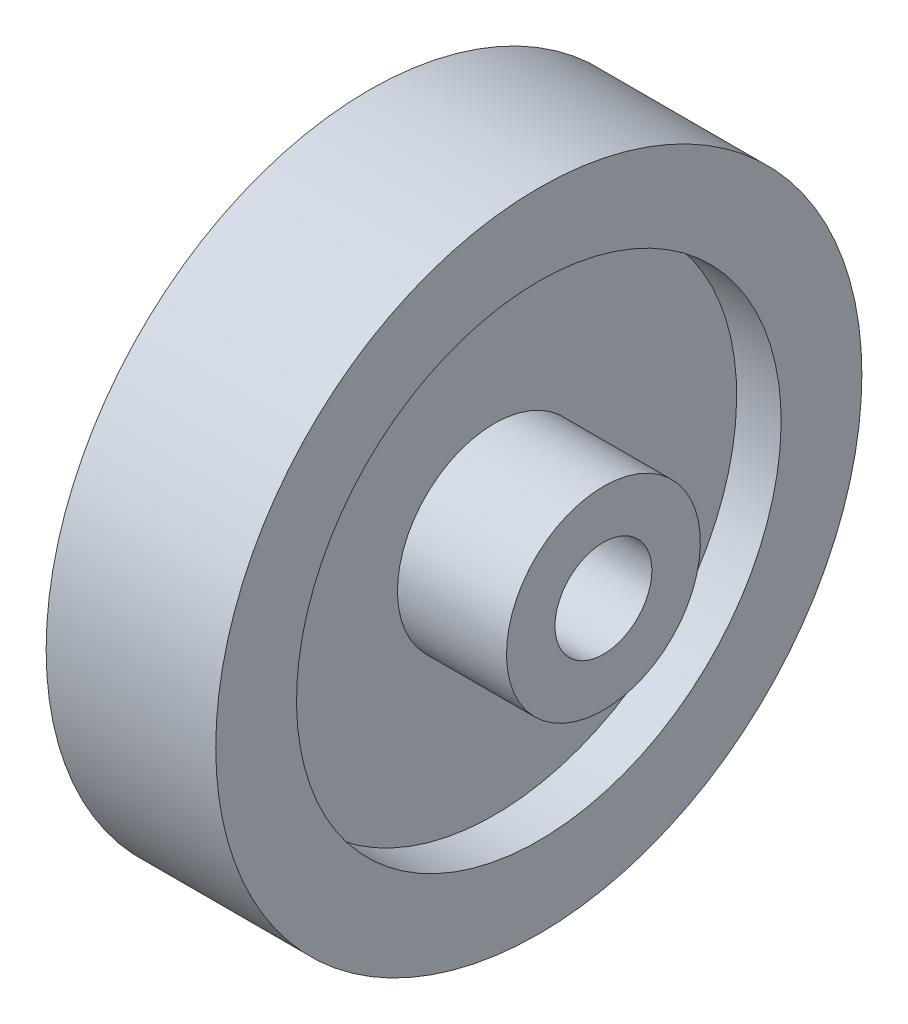
from build123d import *


with BuildPart() as part:
    # Esquisse1 → Révolution1 (revolve)
    with BuildSketch(Plane.XY):
        Polygon((18.5, 6), (-18.5, 6), (-18.5, 12), (-5, 12), (-5, 30), (-10.5, 30), (-10.5, 40), (10.5, 40), (10.5, 30), (5, 30), (5, 12), (18.5, 12), align=None)
    revolve(axis=Axis((0, 0, 0), (-1, 0, 0)))


solid = part.part
